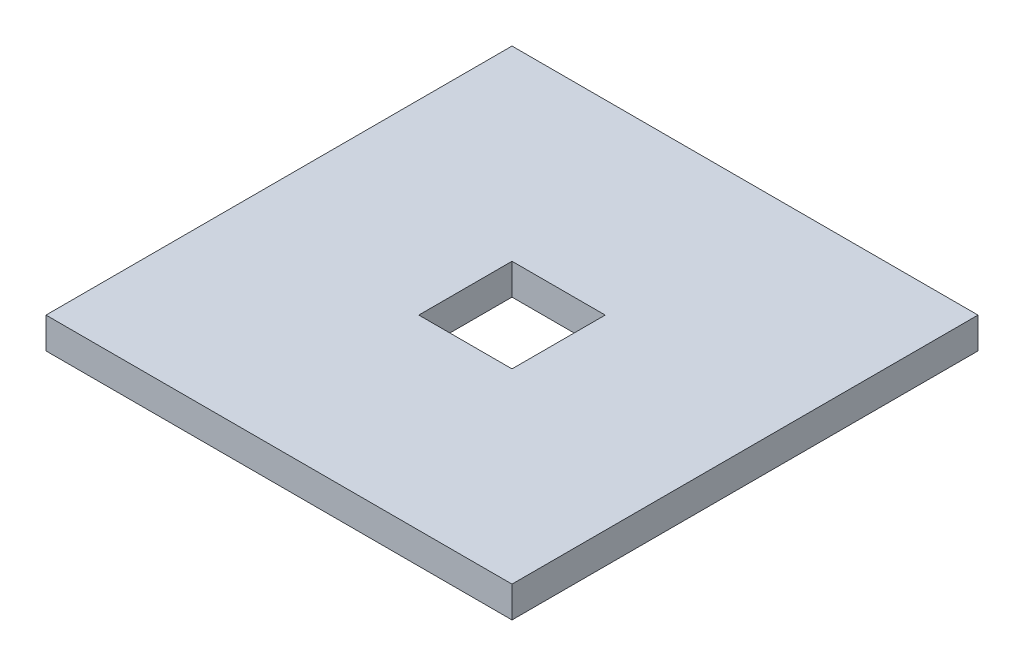
from build123d import *

# Parameters (mm, degrees)
SKETCH1_W           = 1500
SKETCH1_H           = 1500
SKETCH1_W_2         = 300
SKETCH1_H_2         = 300
BOSS_EXTRUDE1_DEPTH = 100


with BuildPart() as part:
    # Sketch1 → Boss-Extrude1 (new body)
    with BuildSketch(Plane(origin=(0, 0, 0), x_dir=(1, 0, 0), z_dir=(0, 1, 0))):
        with Locations((750, 750)):
            Rectangle(SKETCH1_W, SKETCH1_H)
        with Locations((750, 750)):
            Rectangle(SKETCH1_W_2, SKETCH1_H_2, mode=Mode.SUBTRACT)
    extrude(amount=BOSS_EXTRUDE1_DEPTH)


solid = part.part
